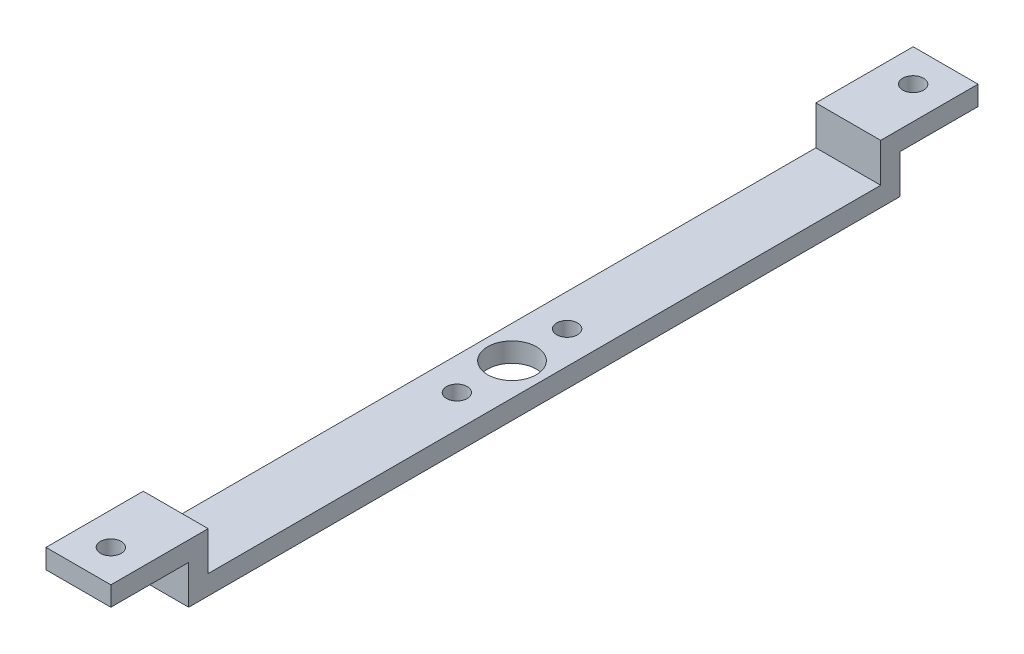
from build123d import *

# Parameters (mm, degrees)
SALIENTE_EXTRUIR1_DEPTH = 10
CROQUIS2_R              = 1.6
CORTAR_EXTRUIR1_DEPTH   = 10
CORTAR_EXTRUIR2_START   = 10
CROQUIS2_2_R            = 1.6
CORTAR_EXTRUIR2_DEPTH   = 10
CROQUIS3_R              = 3.75
CORTAR_EXTRUIR3_DEPTH   = 10


with BuildPart() as part:
    # Croquis1 → Saliente-Extruir1 (new body)
    with BuildSketch(Plane(origin=(0, 0, 0), x_dir=(0, 0, -1), z_dir=(1, 0, 0))):
        Polygon((-61.85, 0), (-66.85, 0), (-66.85, -3), (-54.85, -3), (-54.85, -6), (-54.85, -9), (54.85, -9), (54.85, -6), (54.85, -3), (66.85, -3), (66.85, 0), (61.85, 0), (51.85, 0), (51.85, -6), (-51.85, -6), (-51.85, 0), align=None)
    extrude(amount=SALIENTE_EXTRUIR1_DEPTH)

    # Croquis2 → Cortar-Extruir1 (cut)
    with BuildSketch(Plane(origin=(0, -6, 0), x_dir=(1, 0, 0), z_dir=(0, 1, 0))):
        with Locations((5, -61.85)):
            Circle(CROQUIS2_R)
        with Locations((5, 61.85)):
            Circle(CROQUIS2_R)
        with Locations((5, -8.5)):
            Circle(CROQUIS2_R)
        with Locations((5, 8.5)):
            Circle(CROQUIS2_R)
    extrude(amount=-CORTAR_EXTRUIR1_DEPTH, mode=Mode.SUBTRACT)

    # Croquis2<2> → Cortar-Extruir2 (cut)
    with BuildSketch(Plane(origin=(0, -6, 0), x_dir=(1, 0, 0), z_dir=(0, 1, 0)).offset(CORTAR_EXTRUIR2_START)):
        with Locations((5, -61.85)):
            Circle(CROQUIS2_2_R)
        with Locations((5, 61.85)):
            Circle(CROQUIS2_2_R)
        with Locations((5, -8.5)):
            Circle(CROQUIS2_2_R)
        with Locations((5, 8.5)):
            Circle(CROQUIS2_2_R)
    extrude(amount=-CORTAR_EXTRUIR2_DEPTH, mode=Mode.SUBTRACT)

    # Croquis3 → Cortar-Extruir3 (cut)
    with BuildSketch(Plane(origin=(0, -6, 0), x_dir=(1, 0, 0), z_dir=(0, 1, 0))):
        with Locations((5, 0)):
            Circle(CROQUIS3_R)
    extrude(amount=-CORTAR_EXTRUIR3_DEPTH, mode=Mode.SUBTRACT)


solid = part.part
